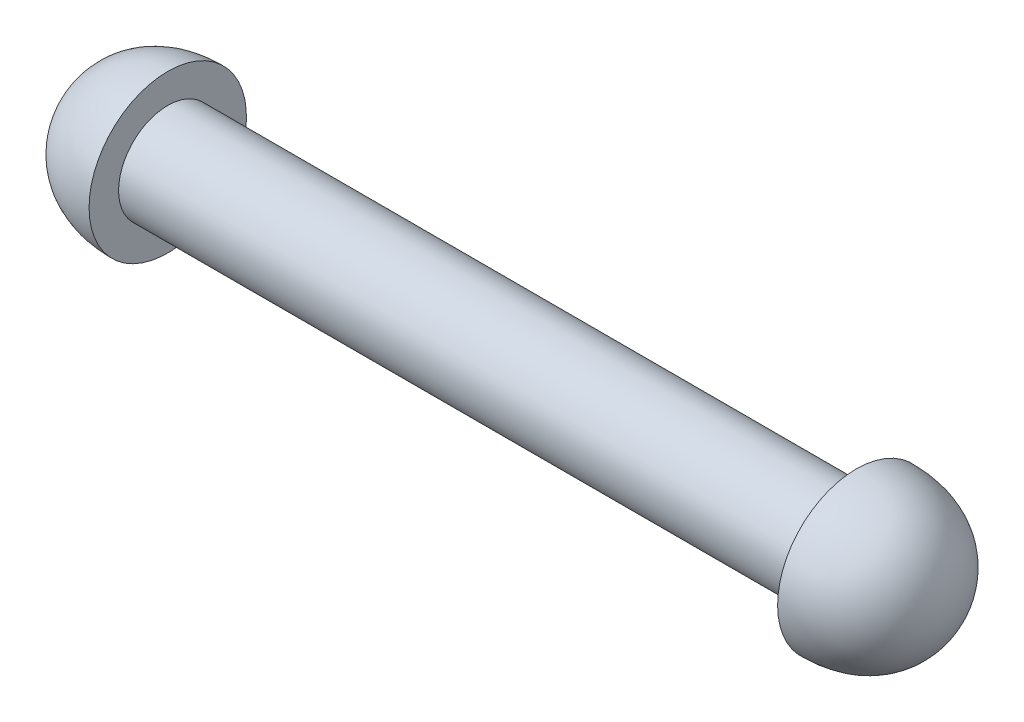
from build123d import *

# Parameters (mm, degrees)
SKETCH1_R           = 25
BOSS_EXTRUDE1_DEPTH = 175


with BuildPart() as part:
    # Sketch1 → Boss-Extrude1 (new body)
    with BuildSketch(Plane(origin=(0, 0, 0), x_dir=(0, 0, -1), z_dir=(1, 0, 0))):
        Circle(SKETCH1_R)
    boss_extrude1 = extrude(amount=BOSS_EXTRUDE1_DEPTH)

    # Sketch3 → Revolve1 (revolve)
    with BuildSketch(Plane.XY, mode=Mode.PRIVATE) as revolve1_sk:
        with BuildLine():
            Line((0, 0), (-45.458392513, 0))
            add(Edge.make_bspline(
                [(-45.458392513, 0), (-45.458392513, 20.183781855), (-30.991238831, 40), (0, 40)],
                knots=[0, 0, 0, 0, 1, 1, 1, 1], degree=3))
            Line((0, 40), (0, 0))
        make_face()
    revolve1 = revolve(revolve1_sk.sketch.rotate(Axis((-100.078673334, 0, 0), (1, 0, 0)), 90), axis=Axis((-100.078673334, 0, 0), (1, 0, 0)))

    # Mirror1: Boss-Extrude1, Revolve1 across plane
    add(boss_extrude1.mirror(Plane(origin=(175, 0, 0), x_dir=(0, 0, 1), z_dir=(1, 0, 0))))
    add(revolve1.mirror(Plane(origin=(175, 0, 0), x_dir=(0, 0, 1), z_dir=(1, 0, 0))))


solid = part.part
